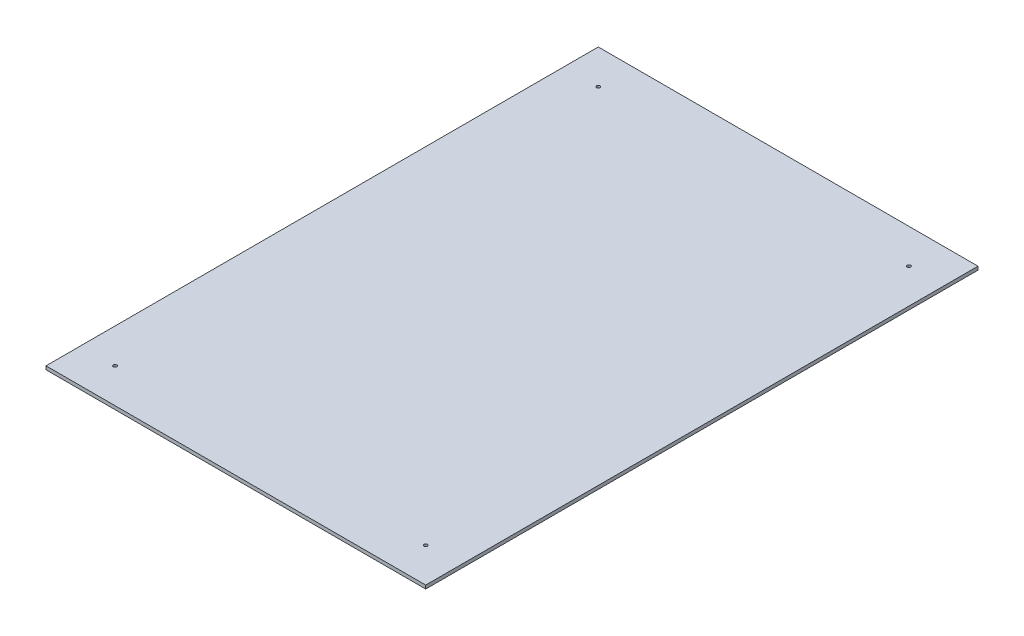
from build123d import *

# Parameters (mm, degrees)
SKETCH1_W                = 550
SKETCH1_H                = 800
BOSS_EXTRUDE1_DEPTH      = 5
F_5_0_5_DIAMETER_HOLE1_D = 5


with BuildPart() as part:
    # Sketch1 → Boss-Extrude1 (new body)
    with BuildSketch(Plane(origin=(0, 0, 0), x_dir=(1, 0, 0), z_dir=(0, 1, 0))):
        Rectangle(SKETCH1_W, SKETCH1_H)
    extrude(amount=BOSS_EXTRUDE1_DEPTH)

    # Ø5.0 (5) Diameter Hole1 (through all)
    with Locations(Plane(origin=(0, 5, 0), x_dir=(1, 0, 0), z_dir=(0, 1, 0))):
        with Locations((-225, 350), (225, 350), (-225, -350), (225, -350)):
            Hole(F_5_0_5_DIAMETER_HOLE1_D / 2)


solid = part.part
